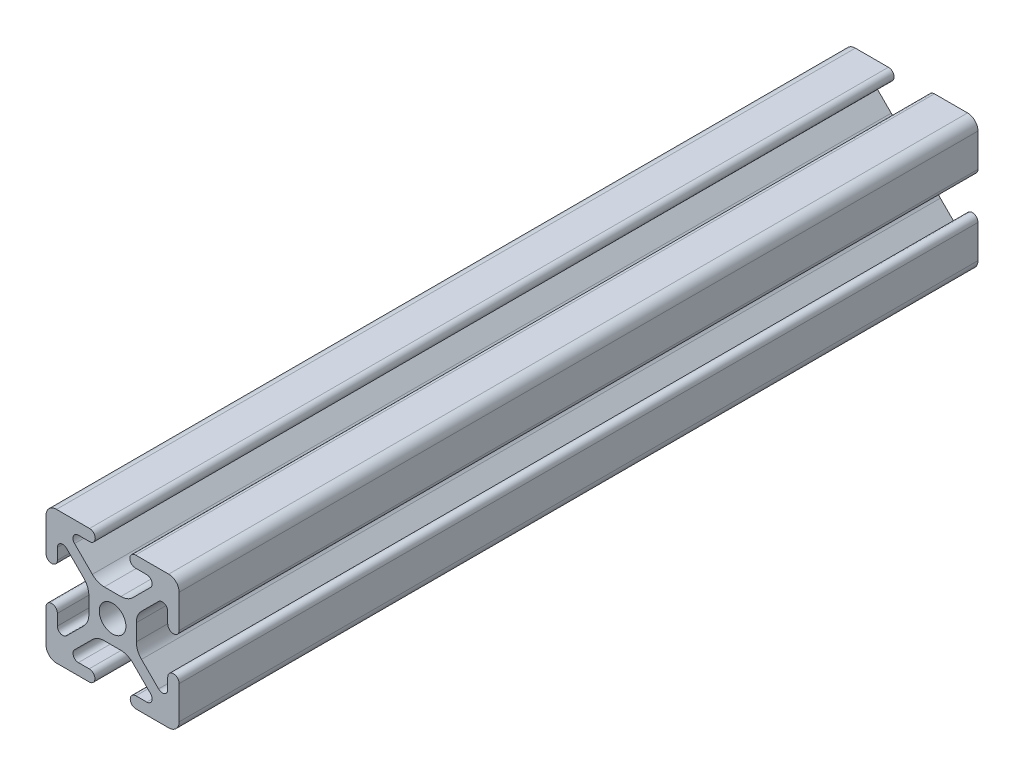
from build123d import *

# Parameters (mm, degrees)
SKETCH1_R      = 2.5
EXTRUDE1_DEPTH = 150


with BuildPart() as part:
    # Sketch1 → Extrude1 (new body)
    with BuildSketch(Plane.XY):
        with BuildLine():
            Line((-8.636346088, 7.111588351), (-5.432204773, 3.912143135))
            ThreePointArc((-5.432204773, 3.912143135), (-4.708985779, 2.831057106), (-4.455, 1.555406707))
            Line((-4.455, 1.555406707), (-4.455, -1.555406707))
            ThreePointArc((-4.455, -1.555406707), (-4.708985779, -2.831057106), (-5.432204773, -3.912143135))
            Line((-5.432204773, -3.912143135), (-8.636346088, -7.111588351))
            ThreePointArc((-8.636346088, -7.111588351), (-9.736852394, -7.329863489), (-10.36, -6.396886949))
            Line((-10.36, -6.396886949), (-10.36, -4.32))
            ThreePointArc((-10.36, -4.32), (-11.43, -3.25), (-12.5, -4.32))
            Line((-12.5, -4.32), (-12.5, -8.651801989))
            Line((-12.5, -8.651801989), (-12.5, -10.537068835))
            ThreePointArc((-12.5, -10.537068835), (-11.925070773, -11.925070773), (-10.537068835, -12.5))
            Line((-10.537068835, -12.5), (-8.441567612, -12.5))
            Line((-8.441567612, -12.5), (-4.387856959, -12.5))
            ThreePointArc((-4.387856959, -12.5), (-3.317856959, -11.43), (-4.387856959, -10.36))
            Line((-4.387856959, -10.36), (-6.42, -10.36))
            ThreePointArc((-6.42, -10.36), (-7.35325999, -9.736168088), (-7.133653912, -8.635298598))
            Line((-7.133653912, -8.635298598), (-3.795290766, -5.301828272))
            ThreePointArc((-3.795290766, -5.301828272), (-2.76743922, -4.61585726), (-1.555406707, -4.375))
            Line((-1.555406707, -4.375), (1.555406707, -4.375))
            ThreePointArc((1.555406707, -4.375), (2.76743922, -4.61585726), (3.795290766, -5.301828272))
            Line((3.795290766, -5.301828272), (7.133653912, -8.635298598))
            ThreePointArc((7.133653912, -8.635298598), (7.35325999, -9.736168088), (6.42, -10.36))
            Line((6.42, -10.36), (4.387856959, -10.36))
            ThreePointArc((4.387856959, -10.36), (3.317856959, -11.43), (4.387856959, -12.5))
            Line((4.387856959, -12.5), (8.441567612, -12.5))
            Line((8.441567612, -12.5), (10.537068835, -12.5))
            ThreePointArc((10.537068835, -12.5), (11.925070773, -11.925070773), (12.5, -10.537068835))
            Line((12.5, -10.537068835), (12.5, -8.651801989))
            Line((12.5, -8.651801989), (12.5, -4.32))
            ThreePointArc((12.5, -4.32), (11.43, -3.25), (10.36, -4.32))
            Line((10.36, -4.32), (10.36, -6.396886949))
            ThreePointArc((10.36, -6.396886949), (9.736852394, -7.329863489), (8.636346088, -7.111588351))
            Line((8.636346088, -7.111588351), (5.432204773, -3.912143135))
            ThreePointArc((5.432204773, -3.912143135), (4.708985779, -2.831057106), (4.455, -1.555406707))
            Line((4.455, -1.555406707), (4.455, 1.555406707))
            ThreePointArc((4.455, 1.555406707), (4.708985779, 2.831057106), (5.432204773, 3.912143135))
            Line((5.432204773, 3.912143135), (8.636346088, 7.111588351))
            ThreePointArc((8.636346088, 7.111588351), (9.736852394, 7.329863489), (10.36, 6.396886949))
            Line((10.36, 6.396886949), (10.36, 4.32))
            ThreePointArc((10.36, 4.32), (11.43, 3.25), (12.5, 4.32))
            Line((12.5, 4.32), (12.5, 7.99129648))
            Line((12.5, 7.99129648), (12.5, 10.537068835))
            ThreePointArc((12.5, 10.537068835), (11.925070773, 11.925070773), (10.537068835, 12.5))
            Line((10.537068835, 12.5), (4.32, 12.5))
            ThreePointArc((4.32, 12.5), (3.25, 11.43), (4.32, 10.36))
            Line((4.32, 10.36), (6.42, 10.36))
            ThreePointArc((6.42, 10.36), (7.35325999, 9.736168088), (7.133653912, 8.635298598))
            Line((7.133653912, 8.635298598), (3.795290766, 5.301828272))
            ThreePointArc((3.795290766, 5.301828272), (2.76743922, 4.61585726), (1.555406707, 4.375))
            Line((1.555406707, 4.375), (-1.555406707, 4.375))
            ThreePointArc((-1.555406707, 4.375), (-2.76743922, 4.61585726), (-3.795290766, 5.301828272))
            Line((-3.795290766, 5.301828272), (-7.133653912, 8.635298598))
            ThreePointArc((-7.133653912, 8.635298598), (-7.35325999, 9.736168088), (-6.42, 10.36))
            Line((-6.42, 10.36), (-4.32, 10.36))
            ThreePointArc((-4.32, 10.36), (-3.25, 11.43), (-4.32, 12.5))
            Line((-4.32, 12.5), (-10.537068835, 12.5))
            ThreePointArc((-10.537068835, 12.5), (-11.925070773, 11.925070773), (-12.5, 10.537068835))
            Line((-12.5, 10.537068835), (-12.5, 7.99129648))
            Line((-12.5, 7.99129648), (-12.5, 4.32))
            ThreePointArc((-12.5, 4.32), (-11.43, 3.25), (-10.36, 4.32))
            Line((-10.36, 4.32), (-10.36, 6.396886949))
            ThreePointArc((-10.36, 6.396886949), (-9.736852394, 7.329863489), (-8.636346088, 7.111588351))
        make_face()
        Circle(SKETCH1_R, mode=Mode.SUBTRACT)
    extrude(amount=-EXTRUDE1_DEPTH)


solid = part.part
